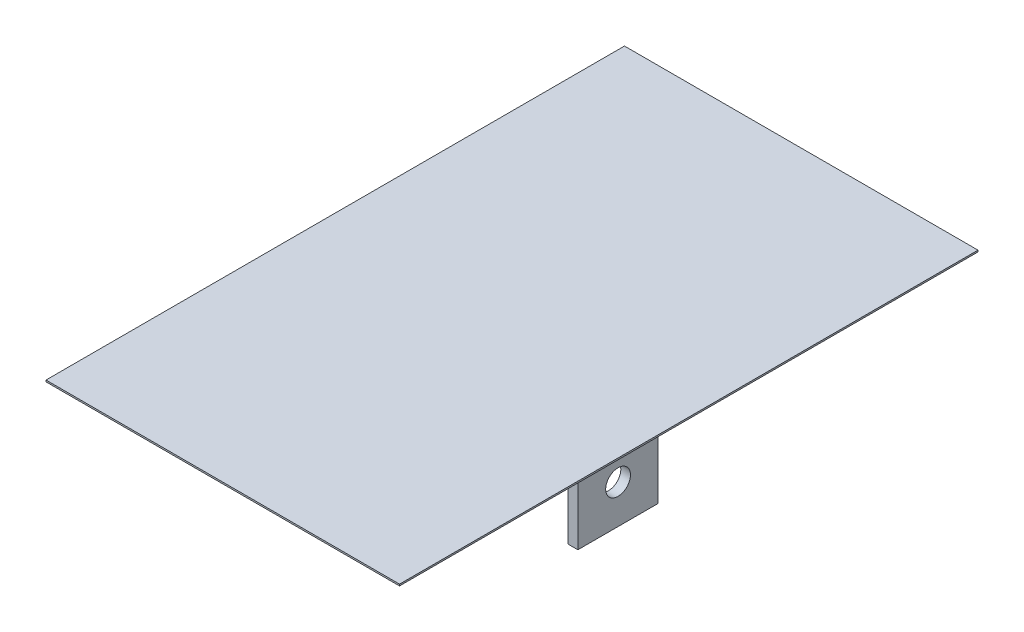
from build123d import *

# Parameters (mm, degrees)
SKETCH1_W           = 110
SKETCH1_H           = 180
BOSS_EXTRUDE1_DEPTH = 0.5
SKETCH1_3_W         = 3
SKETCH1_3_H         = 25
BOSS_EXTRUDE2_DEPTH = 40
SKETCH3_R           = 10.6
CUT_EXTRUDE1_DEPTH  = 1
SKETCH4_R           = 3.85
CUT_EXTRUDE2_DEPTH  = 161.494936001


with BuildPart() as part:
    # Sketch1 → Boss-Extrude1 (new body)
    with BuildSketch(Plane(origin=(0, 0, 0), x_dir=(1, 0, 0), z_dir=(0, 1, 0))):
        with Locations((-78.042251664, -40.129260668)):
            Rectangle(SKETCH1_W, SKETCH1_H)
    extrude(amount=BOSS_EXTRUDE1_DEPTH)

    # Sketch1<3> → Boss-Extrude2 (add)
    with BuildSketch(Plane(origin=(0, 0, 0), x_dir=(1, 0, 0), z_dir=(0, 1, 0))):
        with Locations((-109.542251664, -40.129260668)):
            Rectangle(SKETCH1_3_W, SKETCH1_3_H)
        with Locations((-46.542251664, -40.129260668)):
            Rectangle(SKETCH1_3_W, SKETCH1_3_H)
    extrude(amount=-BOSS_EXTRUDE2_DEPTH)

    # Sketch3 → Cut-Extrude1 (cut)
    with BuildSketch(Plane(origin=(-108.042251664, 0, 0), x_dir=(0, 0, -1), z_dir=(1, 0, 0))):
        with Locations((-40.129260668, -28)):
            Circle(SKETCH3_R)
    extrude(amount=-CUT_EXTRUDE1_DEPTH, mode=Mode.SUBTRACT)

    # Sketch4 → Cut-Extrude2 (cut, through all)
    with BuildSketch(Plane.ZY.offset(48.042251664)):
        with Locations((40.129260668, -28)):
            Circle(SKETCH4_R)
    extrude(amount=-CUT_EXTRUDE2_DEPTH, mode=Mode.SUBTRACT)


solid = part.part
